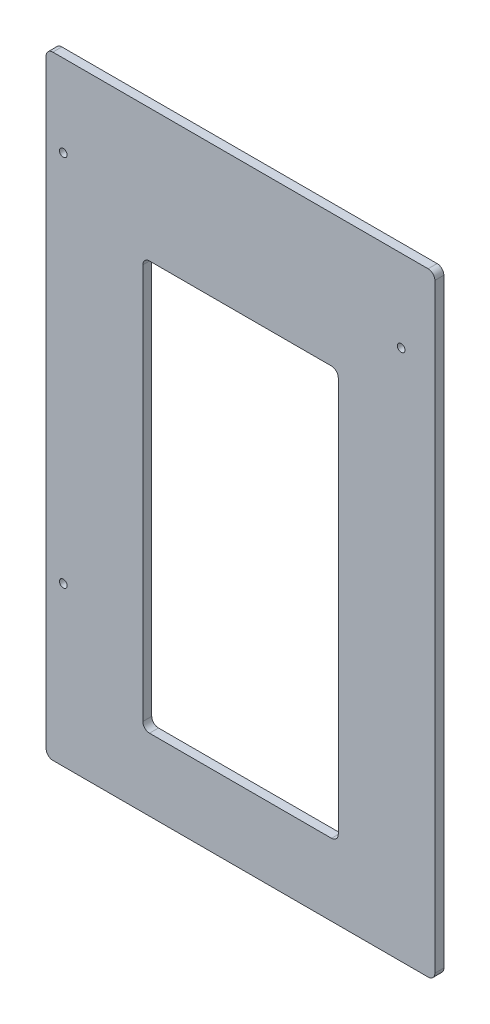
from build123d import *

# Parameters (mm, degrees)
ESQUISSE1_W        = 173
ESQUISSE1_H        = 273
ESQUISSE1_R        = 1.5
ESQUISSE1_W_2      = 87
ESQUISSE1_H_2      = 182
BOSS_EXTRU_1_DEPTH = 4
CONG_1_R           = 3
D_GAGEMENT_M31_D   = 3.4


with BuildPart() as part:
    # Esquisse1 → Boss.-Extru.1 (new body)
    with BuildSketch(Plane.XY):
        with Locations((86.5, 136.5)):
            Rectangle(ESQUISSE1_W, ESQUISSE1_H)
        with Locations((7.62, 236.5)):
            Circle(ESQUISSE1_R, mode=Mode.SUBTRACT)
        with Locations((7.62, 70.5)):
            Circle(ESQUISSE1_R, mode=Mode.SUBTRACT)
        with Locations((158, 236.5)):
            Circle(ESQUISSE1_R, mode=Mode.SUBTRACT)
        with Locations((86.5, 123)):
            Rectangle(ESQUISSE1_W_2, ESQUISSE1_H_2, mode=Mode.SUBTRACT)
    extrude(amount=BOSS_EXTRU_1_DEPTH)

    # Congé1
    cong_1_edges = [part.edges().sort_by_distance(p)[0] for p in [
        (43, 214, 2),
        (43, 32, 2),
        (130, 32, 2),
        (130, 214, 2),
        (0, 273, 2),
        (173, 273, 2),
        (173, 0, 2),
        (0, 0, 2),
    ]]
    fillet(cong_1_edges, radius=CONG_1_R)

    # Dégagement M31 (through all)
    with Locations(Plane.XY.offset(4)):
        with Locations((7.62, 236.5), (7.62, 70.5), (158, 236.5)):
            Hole(D_GAGEMENT_M31_D / 2)


solid = part.part
